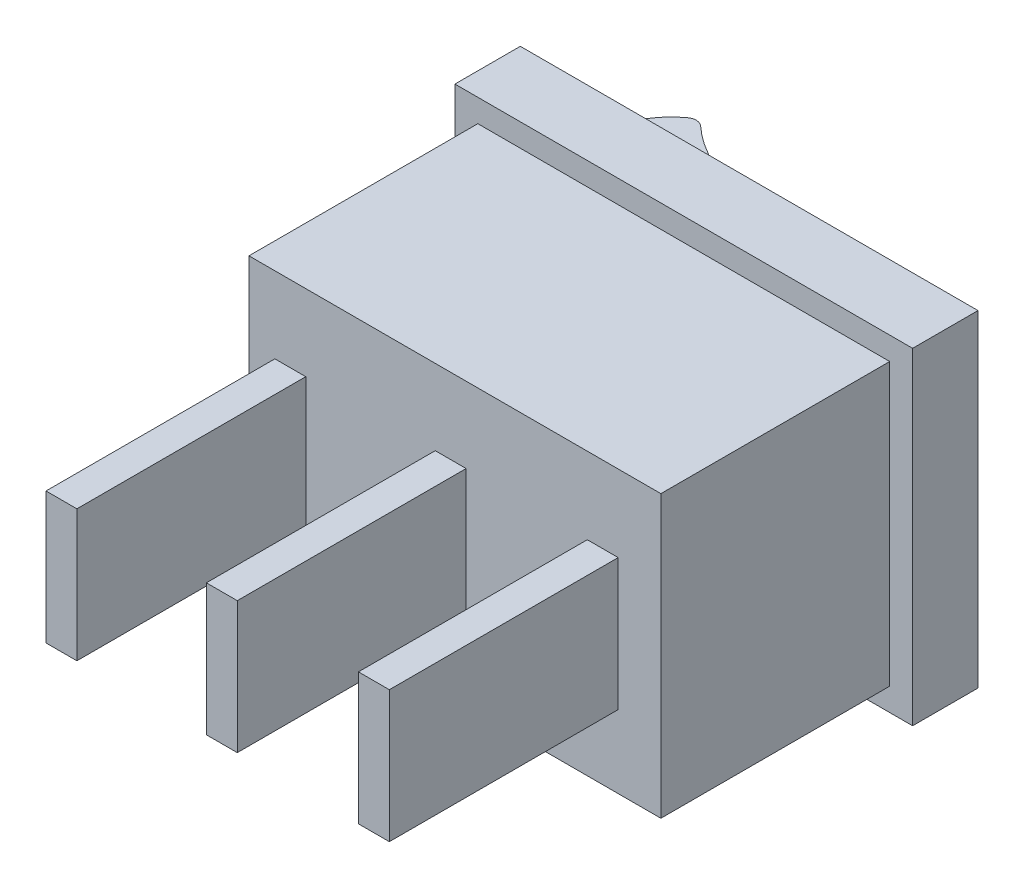
from build123d import *

# Parameters (mm, degrees)
CROQUIS1_W              = 21
CROQUIS1_H              = 15
SALIENTE_EXTRUIR1_DEPTH = 13.5
CROQUIS2_W              = 21
CROQUIS2_H              = 15
CROQUIS2_W_2            = 18.9
CROQUIS2_H_2            = 12.9
CORTAR_EXTRUIR1_DEPTH   = 10.5
SALIENTE_EXTRUIR2_DEPTH = 5.25
REDONDEO1_R             = 0.5
CROQUIS4_W              = 1.418006124
CROQUIS4_H              = 6.039970015
CROQUIS4_H_2            = 6.039970016
SALIENTE_EXTRUIR3_DEPTH = 10.5


with BuildPart() as part:
    # Croquis1 → Saliente-Extruir1 (new body)
    with BuildSketch(Plane.XY):
        Rectangle(CROQUIS1_W, CROQUIS1_H)
    extrude(amount=SALIENTE_EXTRUIR1_DEPTH)

    # Croquis2 → Cortar-Extruir1 (cut)
    with BuildSketch(Plane.XY.offset(13.5)):
        Rectangle(CROQUIS2_W, CROQUIS2_H)
        Rectangle(CROQUIS2_W_2, CROQUIS2_H_2, mode=Mode.SUBTRACT)
    extrude(amount=-CORTAR_EXTRUIR1_DEPTH, mode=Mode.SUBTRACT)

    # Croquis3 → Saliente-Extruir2 (add, symmetric)
    with BuildSketch(Plane(origin=(0, 0, 0), x_dir=(1, 0, 0), z_dir=(0, 1, 0))):
        with BuildLine():
            Line((7.039280928, 0), (-7.963522393, 0))
            add(Edge.make_bspline(
                [(-5.706653699, 3.481138081), (-7.057942912, 2.763187698), (-7.488467217, 1.307416204), (-7.963522393, 0)],
                knots=[0, 0, 0, 0, 1, 1, 1, 1], degree=3))
            add(Edge.make_bspline(
                [(7.039280928, 0), (4.224020061, 0.069217615), (-0.214677684, 0.66683062), (-4.502921069, 2.204677744), (-5.706653699, 3.481138081)],
                knots=[0, 0, 0, 0, 0.62405833, 1, 1, 1, 1], degree=3))
        make_face()
    extrude(amount=SALIENTE_EXTRUIR2_DEPTH, both=True)

    # Redondeo1
    redondeo1_edges = [part.edges().sort_by_distance(p)[0] for p in [
        (-5.706653699, -2.625, -3.481138081),
    ]]
    fillet(redondeo1_edges, radius=REDONDEO1_R)

    # Croquis4 → Saliente-Extruir3 (add)
    with BuildSketch(Plane.XY.offset(13.5)):
        with Locations((-7.552748408, -0.069775705)):
            Rectangle(CROQUIS4_W, CROQUIS4_H)
        with Locations((-0.194042943, -0.039922945)):
            Rectangle(CROQUIS4_W, CROQUIS4_H)
        with Locations((6.78276327, -0.08977409)):
            Rectangle(CROQUIS4_W, CROQUIS4_H_2)
    extrude(amount=SALIENTE_EXTRUIR3_DEPTH)


solid = part.part
